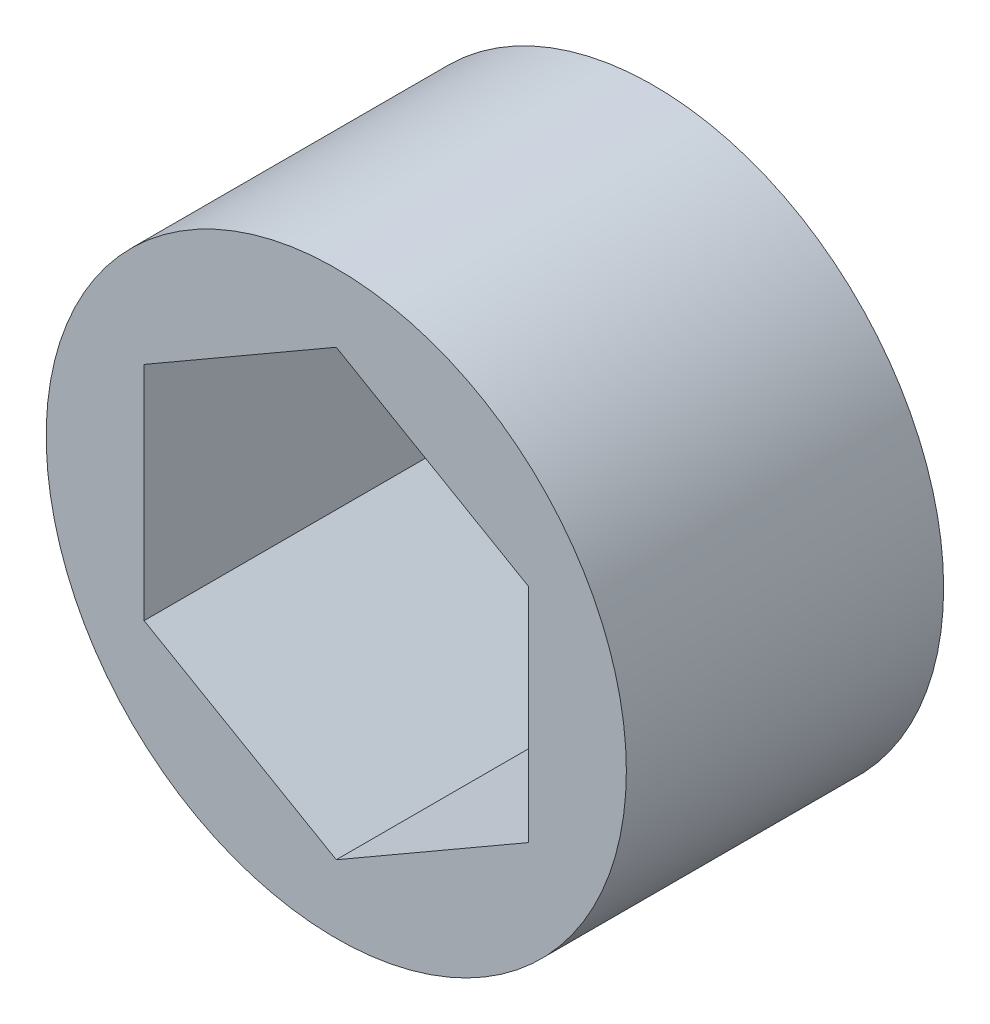
from build123d import *

# Parameters (mm, degrees)
SKETCH1_R           = 10.16
BOSS_EXTRUDE1_DEPTH = 5.55625


with BuildPart() as part:
    # Sketch1 → Boss-Extrude1 (new, symmetric)
    with BuildSketch(Plane.XY):
        Circle(SKETCH1_R)
        Polygon((0, 7.772289324), (-6.731, 3.886144662), (-6.731, -3.886144662), (0, -7.772289324), (6.731, -3.886144662), (6.731, 3.886144662), align=None, mode=Mode.SUBTRACT)
    extrude(amount=BOSS_EXTRUDE1_DEPTH, both=True)


solid = part.part
